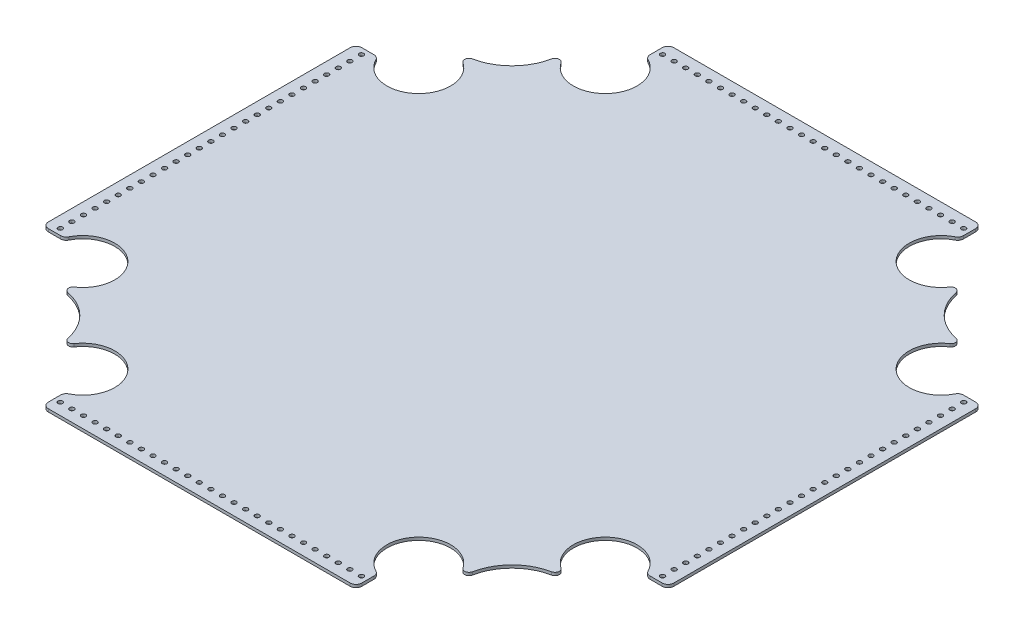
from build123d import *

# Parameters (mm, degrees)
SKETCH1_W           = 685.8
SKETCH1_H           = 685.8
BOSS_EXTRUDE1_DEPTH = 3.175
CUT_EXTRUDE2_DEPTH  = 3.175
SKETCH2_R           = 2.4892
CUT_EXTRUDE1_DEPTH  = 3.175
FILLET1_R           = 6.35


with BuildPart() as part:
    # Sketch1 → Boss-Extrude1 (new body)
    with BuildSketch(Plane(origin=(0, 0, 0), x_dir=(1, 0, 0), z_dir=(0, 1, 0))):
        Rectangle(SKETCH1_W, SKETCH1_H)
    extrude(amount=BOSS_EXTRUDE1_DEPTH)

    # Sketch3 → Cut-Extrude2 (cut)
    with BuildSketch(Plane(origin=(0, 3.175, 0), x_dir=(1, 0, 0), z_dir=(0, 1, 0))):
        with BuildLine():
            Line((-171.831, 319.065236596), (-171.831, 342.9))
            Line((-171.831, 342.9), (-342.9, 342.9))
            Line((-342.9, 342.9), (-342.9, 171.831))
            Line((-342.9, 171.831), (-319.065236596, 171.831))
            ThreePointArc((-319.065236596, 171.831), (-264.697833655, 156.774418893), (-266.915318507, 213.144605146))
            ThreePointArc((-266.915318507, 213.144605146), (-268.931826313, 218.025144056), (-265.204938628, 221.766303232))
            ThreePointArc((-265.204938628, 221.766303232), (-236.93637947, 236.93637947), (-221.766303232, 265.204938628))
            ThreePointArc((-221.766303232, 265.204938628), (-218.025144056, 268.931826313), (-213.144605146, 266.915318507))
            ThreePointArc((-213.144605146, 266.915318507), (-156.774418893, 264.697833655), (-171.831, 319.065236596))
        make_face()
        with BuildLine():
            Line((342.9, 342.9), (171.831, 342.9))
            Line((171.831, 342.9), (171.831, 319.065236596))
            ThreePointArc((171.831, 319.065236596), (156.774418893, 264.697833655), (213.144605146, 266.915318507))
            ThreePointArc((213.144605146, 266.915318507), (218.025144056, 268.931826313), (221.766303232, 265.204938628))
            ThreePointArc((221.766303232, 265.204938628), (236.93637947, 236.93637947), (265.204938628, 221.766303232))
            ThreePointArc((265.204938628, 221.766303232), (268.931826313, 218.025144056), (266.915318507, 213.144605146))
            ThreePointArc((266.915318507, 213.144605146), (264.697833655, 156.774418893), (319.065236596, 171.831))
            Line((319.065236596, 171.831), (342.9, 171.831))
            Line((342.9, 171.831), (342.9, 342.9))
        make_face()
        with BuildLine():
            Line((171.831, -319.065236596), (171.831, -342.9))
            Line((171.831, -342.9), (342.9, -342.9))
            Line((342.9, -342.9), (342.9, -171.831))
            Line((342.9, -171.831), (319.065236596, -171.831))
            ThreePointArc((319.065236596, -171.831), (264.697833655, -156.774418893), (266.915318507, -213.144605146))
            ThreePointArc((266.915318507, -213.144605146), (268.931826313, -218.025144056), (265.204938628, -221.766303232))
            ThreePointArc((265.204938628, -221.766303232), (236.93637947, -236.93637947), (221.766303232, -265.204938628))
            ThreePointArc((221.766303232, -265.204938628), (218.025144056, -268.931826313), (213.144605146, -266.915318507))
            ThreePointArc((213.144605146, -266.915318507), (156.774418893, -264.697833655), (171.831, -319.065236596))
        make_face()
        with BuildLine():
            Line((-342.9, -342.9), (-171.831, -342.9))
            Line((-171.831, -342.9), (-171.831, -319.065236596))
            ThreePointArc((-171.831, -319.065236596), (-156.774418893, -264.697833655), (-213.144605146, -266.915318507))
            ThreePointArc((-213.144605146, -266.915318507), (-218.025144056, -268.931826313), (-221.766303232, -265.204938628))
            ThreePointArc((-221.766303232, -265.204938628), (-236.93637947, -236.93637947), (-265.204938628, -221.766303232))
            ThreePointArc((-265.204938628, -221.766303232), (-268.931826313, -218.025144056), (-266.915318507, -213.144605146))
            ThreePointArc((-266.915318507, -213.144605146), (-264.697833655, -156.774418893), (-319.065236596, -171.831))
            Line((-319.065236596, -171.831), (-342.9, -171.831))
            Line((-342.9, -171.831), (-342.9, -342.9))
        make_face()
    extrude(amount=-CUT_EXTRUDE2_DEPTH, mode=Mode.SUBTRACT)

    # Sketch2 → Cut-Extrude1 (cut)
    with BuildSketch(Plane(origin=(0, 3.175, 0), x_dir=(1, 0, 0), z_dir=(0, 1, 0))):
        with Locations(Location((165.1, 330.2, 0), (0, 0, 270))):
            Circle(SKETCH2_R)
        with Locations(Location((152.4, 330.2, 0), (0, 0, 270))):
            Circle(SKETCH2_R)
        with Locations(Location((139.7, 330.2, 0), (0, 0, 270))):
            Circle(SKETCH2_R)
        with Locations(Location((127, 330.2, 0), (0, 0, 270))):
            Circle(SKETCH2_R)
        with Locations(Location((114.3, 330.2, 0), (0, 0, 270))):
            Circle(SKETCH2_R)
        with Locations(Location((101.6, 330.2, 0), (0, 0, 270))):
            Circle(SKETCH2_R)
        with Locations(Location((88.9, 330.2, 0), (0, 0, 270))):
            Circle(SKETCH2_R)
        with Locations(Location((76.2, 330.2, 0), (0, 0, 270))):
            Circle(SKETCH2_R)
        with Locations(Location((63.5, 330.2, 0), (0, 0, 270))):
            Circle(SKETCH2_R)
        with Locations(Location((50.8, 330.2, 0), (0, 0, 270))):
            Circle(SKETCH2_R)
        with Locations(Location((38.1, 330.2, 0), (0, 0, 270))):
            Circle(SKETCH2_R)
        with Locations(Location((25.4, 330.2, 0), (0, 0, 270))):
            Circle(SKETCH2_R)
        with Locations(Location((12.7, 330.2, 0), (0, 0, 270))):
            Circle(SKETCH2_R)
        with Locations(Location((0, 330.2, 0), (0, 0, 270))):
            Circle(SKETCH2_R)
        with Locations(Location((-12.7, 330.2, 0), (0, 0, 270))):
            Circle(SKETCH2_R)
        with Locations(Location((-25.4, 330.2, 0), (0, 0, 270))):
            Circle(SKETCH2_R)
        with Locations(Location((-38.1, 330.2, 0), (0, 0, 270))):
            Circle(SKETCH2_R)
        with Locations(Location((-50.8, 330.2, 0), (0, 0, 270))):
            Circle(SKETCH2_R)
        with Locations(Location((-63.5, 330.2, 0), (0, 0, 270))):
            Circle(SKETCH2_R)
        with Locations(Location((-76.2, 330.2, 0), (0, 0, 270))):
            Circle(SKETCH2_R)
        with Locations(Location((-88.9, 330.2, 0), (0, 0, 270))):
            Circle(SKETCH2_R)
        with Locations(Location((-101.6, 330.2, 0), (0, 0, 270))):
            Circle(SKETCH2_R)
        with Locations(Location((-114.3, 330.2, 0), (0, 0, 270))):
            Circle(SKETCH2_R)
        with Locations(Location((-127, 330.2, 0), (0, 0, 270))):
            Circle(SKETCH2_R)
        with Locations(Location((-139.7, 330.2, 0), (0, 0, 270))):
            Circle(SKETCH2_R)
        with Locations(Location((-152.4, 330.2, 0), (0, 0, 270))):
            Circle(SKETCH2_R)
        with Locations(Location((-165.1, 330.2, 0), (0, 0, 270))):
            Circle(SKETCH2_R)
        with Locations(Location((-330.2, 165.1, 0), (0, 0, 270))):
            Circle(SKETCH2_R)
        with Locations(Location((-330.2, 152.4, 0), (0, 0, 270))):
            Circle(SKETCH2_R)
        with Locations(Location((-330.2, 139.7, 0), (0, 0, 270))):
            Circle(SKETCH2_R)
        with Locations(Location((-330.2, 127, 0), (0, 0, 270))):
            Circle(SKETCH2_R)
        with Locations(Location((-330.2, 114.3, 0), (0, 0, 270))):
            Circle(SKETCH2_R)
        with Locations(Location((-330.2, 101.6, 0), (0, 0, 270))):
            Circle(SKETCH2_R)
        with Locations(Location((-330.2, 88.9, 0), (0, 0, 270))):
            Circle(SKETCH2_R)
        with Locations(Location((-330.2, 76.2, 0), (0, 0, 270))):
            Circle(SKETCH2_R)
        with Locations(Location((-330.2, 63.5, 0), (0, 0, 270))):
            Circle(SKETCH2_R)
        with Locations(Location((-330.2, 50.8, 0), (0, 0, 270))):
            Circle(SKETCH2_R)
        with Locations(Location((-330.2, 38.1, 0), (0, 0, 270))):
            Circle(SKETCH2_R)
        with Locations(Location((-330.2, 25.4, 0), (0, 0, 270))):
            Circle(SKETCH2_R)
        with Locations(Location((-330.2, 12.7, 0), (0, 0, 270))):
            Circle(SKETCH2_R)
        with Locations(Location((-330.2, 0, 0), (0, 0, 270))):
            Circle(SKETCH2_R)
        with Locations(Location((-330.2, -12.7, 0), (0, 0, 270))):
            Circle(SKETCH2_R)
        with Locations(Location((-330.2, -25.4, 0), (0, 0, 270))):
            Circle(SKETCH2_R)
        with Locations(Location((-330.2, -38.1, 0), (0, 0, 270))):
            Circle(SKETCH2_R)
        with Locations(Location((-330.2, -50.8, 0), (0, 0, 270))):
            Circle(SKETCH2_R)
        with Locations(Location((-330.2, -63.5, 0), (0, 0, 270))):
            Circle(SKETCH2_R)
        with Locations(Location((-330.2, -76.2, 0), (0, 0, 270))):
            Circle(SKETCH2_R)
        with Locations(Location((-330.2, -88.9, 0), (0, 0, 270))):
            Circle(SKETCH2_R)
        with Locations(Location((-330.2, -101.6, 0), (0, 0, 270))):
            Circle(SKETCH2_R)
        with Locations(Location((-330.2, -114.3, 0), (0, 0, 270))):
            Circle(SKETCH2_R)
        with Locations(Location((-330.2, -127, 0), (0, 0, 270))):
            Circle(SKETCH2_R)
        with Locations(Location((-330.2, -139.7, 0), (0, 0, 270))):
            Circle(SKETCH2_R)
        with Locations(Location((-330.2, -152.4, 0), (0, 0, 270))):
            Circle(SKETCH2_R)
        with Locations(Location((-330.2, -165.1, 0), (0, 0, 270))):
            Circle(SKETCH2_R)
        with Locations(Location((-165.1, -330.2, 0), (0, 0, 270))):
            Circle(SKETCH2_R)
        with Locations(Location((-152.4, -330.2, 0), (0, 0, 270))):
            Circle(SKETCH2_R)
        with Locations(Location((-139.7, -330.2, 0), (0, 0, 270))):
            Circle(SKETCH2_R)
        with Locations(Location((-127, -330.2, 0), (0, 0, 270))):
            Circle(SKETCH2_R)
        with Locations(Location((-114.3, -330.2, 0), (0, 0, 270))):
            Circle(SKETCH2_R)
        with Locations(Location((-101.6, -330.2, 0), (0, 0, 270))):
            Circle(SKETCH2_R)
        with Locations(Location((-88.9, -330.2, 0), (0, 0, 270))):
            Circle(SKETCH2_R)
        with Locations(Location((-76.2, -330.2, 0), (0, 0, 270))):
            Circle(SKETCH2_R)
        with Locations(Location((-63.5, -330.2, 0), (0, 0, 270))):
            Circle(SKETCH2_R)
        with Locations(Location((-50.8, -330.2, 0), (0, 0, 270))):
            Circle(SKETCH2_R)
        with Locations(Location((-38.1, -330.2, 0), (0, 0, 270))):
            Circle(SKETCH2_R)
        with Locations(Location((-25.4, -330.2, 0), (0, 0, 270))):
            Circle(SKETCH2_R)
        with Locations(Location((-12.7, -330.2, 0), (0, 0, 270))):
            Circle(SKETCH2_R)
        with Locations(Location((0, -330.2, 0), (0, 0, 270))):
            Circle(SKETCH2_R)
        with Locations(Location((12.7, -330.2, 0), (0, 0, 270))):
            Circle(SKETCH2_R)
        with Locations(Location((25.4, -330.2, 0), (0, 0, 270))):
            Circle(SKETCH2_R)
        with Locations(Location((38.1, -330.2, 0), (0, 0, 270))):
            Circle(SKETCH2_R)
        with Locations(Location((50.8, -330.2, 0), (0, 0, 270))):
            Circle(SKETCH2_R)
        with Locations(Location((63.5, -330.2, 0), (0, 0, 270))):
            Circle(SKETCH2_R)
        with Locations(Location((76.2, -330.2, 0), (0, 0, 270))):
            Circle(SKETCH2_R)
        with Locations(Location((88.9, -330.2, 0), (0, 0, 270))):
            Circle(SKETCH2_R)
        with Locations(Location((101.6, -330.2, 0), (0, 0, 270))):
            Circle(SKETCH2_R)
        with Locations(Location((114.3, -330.2, 0), (0, 0, 270))):
            Circle(SKETCH2_R)
        with Locations(Location((127, -330.2, 0), (0, 0, 270))):
            Circle(SKETCH2_R)
        with Locations(Location((139.7, -330.2, 0), (0, 0, 270))):
            Circle(SKETCH2_R)
        with Locations(Location((152.4, -330.2, 0), (0, 0, 270))):
            Circle(SKETCH2_R)
        with Locations(Location((165.1, -330.2, 0), (0, 0, 270))):
            Circle(SKETCH2_R)
        with Locations(Location((330.2, -165.1, 0), (0, 0, 270))):
            Circle(SKETCH2_R)
        with Locations(Location((330.2, -152.4, 0), (0, 0, 270))):
            Circle(SKETCH2_R)
        with Locations(Location((330.2, -139.7, 0), (0, 0, 270))):
            Circle(SKETCH2_R)
        with Locations(Location((330.2, -127, 0), (0, 0, 270))):
            Circle(SKETCH2_R)
        with Locations(Location((330.2, -114.3, 0), (0, 0, 270))):
            Circle(SKETCH2_R)
        with Locations(Location((330.2, -101.6, 0), (0, 0, 270))):
            Circle(SKETCH2_R)
        with Locations(Location((330.2, -88.9, 0), (0, 0, 270))):
            Circle(SKETCH2_R)
        with Locations(Location((330.2, -76.2, 0), (0, 0, 270))):
            Circle(SKETCH2_R)
        with Locations(Location((330.2, -63.5, 0), (0, 0, 270))):
            Circle(SKETCH2_R)
        with Locations(Location((330.2, -50.8, 0), (0, 0, 270))):
            Circle(SKETCH2_R)
        with Locations(Location((330.2, -38.1, 0), (0, 0, 270))):
            Circle(SKETCH2_R)
        with Locations(Location((330.2, -25.4, 0), (0, 0, 270))):
            Circle(SKETCH2_R)
        with Locations(Location((330.2, -12.7, 0), (0, 0, 270))):
            Circle(SKETCH2_R)
        with Locations(Location((330.2, 0, 0), (0, 0, 270))):
            Circle(SKETCH2_R)
        with Locations(Location((330.2, 12.7, 0), (0, 0, 270))):
            Circle(SKETCH2_R)
        with Locations(Location((330.2, 25.4, 0), (0, 0, 270))):
            Circle(SKETCH2_R)
        with Locations(Location((330.2, 38.1, 0), (0, 0, 270))):
            Circle(SKETCH2_R)
        with Locations(Location((330.2, 50.8, 0), (0, 0, 270))):
            Circle(SKETCH2_R)
        with Locations(Location((330.2, 63.5, 0), (0, 0, 270))):
            Circle(SKETCH2_R)
        with Locations(Location((330.2, 76.2, 0), (0, 0, 270))):
            Circle(SKETCH2_R)
        with Locations(Location((330.2, 88.9, 0), (0, 0, 270))):
            Circle(SKETCH2_R)
        with Locations(Location((330.2, 101.6, 0), (0, 0, 270))):
            Circle(SKETCH2_R)
        with Locations(Location((330.2, 114.3, 0), (0, 0, 270))):
            Circle(SKETCH2_R)
        with Locations(Location((330.2, 127, 0), (0, 0, 270))):
            Circle(SKETCH2_R)
        with Locations(Location((330.2, 139.7, 0), (0, 0, 270))):
            Circle(SKETCH2_R)
        with Locations(Location((330.2, 152.4, 0), (0, 0, 270))):
            Circle(SKETCH2_R)
        with Locations(Location((330.2, 165.1, 0), (0, 0, 270))):
            Circle(SKETCH2_R)
    extrude(amount=-CUT_EXTRUDE1_DEPTH, mode=Mode.SUBTRACT)

    # Fillet1
    fillet1_edges = [part.edges().sort_by_distance(p)[0] for p in [
        (-171.831, 1.5875, 319.065236596),
        (-171.831, 1.5875, 342.9),
        (-342.9, 1.5875, 171.831),
        (-319.065236596, 1.5875, 171.831),
        (319.065236596, 1.5875, 171.831),
        (342.9, 1.5875, 171.831),
        (171.831, 1.5875, 342.9),
        (171.831, 1.5875, 319.065236596),
        (171.831, 1.5875, -319.065236596),
        (171.831, 1.5875, -342.9),
        (342.9, 1.5875, -171.831),
        (319.065236596, 1.5875, -171.831),
        (-171.831, 1.5875, -319.065236596),
        (-319.065236596, 1.5875, -171.831),
        (-342.9, 1.5875, -171.831),
        (-171.831, 1.5875, -342.9),
    ]]
    fillet(fillet1_edges, radius=FILLET1_R)


solid = part.part
